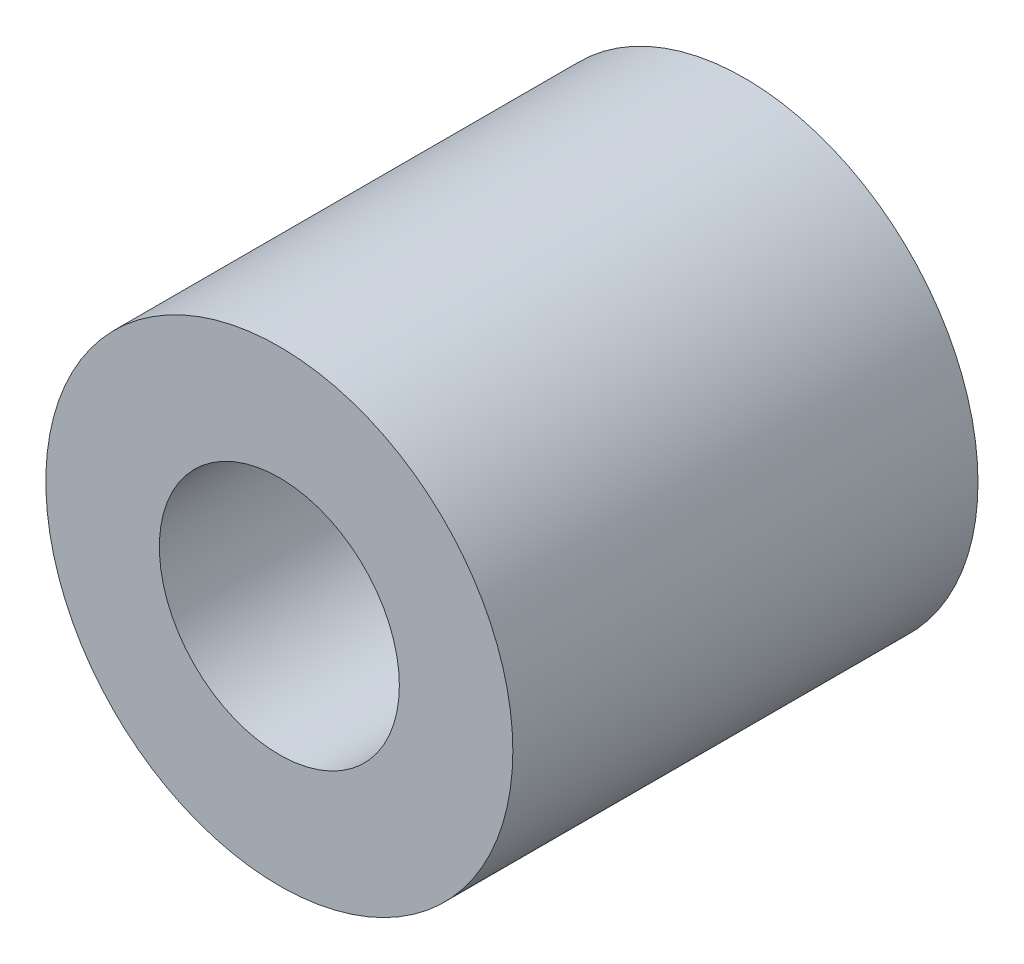
from build123d import *

# Parameters (mm, degrees)
SKETCH1_R      = 3.1877
SKETCH1_R_2    = 1.6383
EXTRUDE1_DEPTH = 3.175


with BuildPart() as part:
    # Sketch1 → Extrude1 (new, symmetric)
    with BuildSketch(Plane.XY):
        Circle(SKETCH1_R)
        Circle(SKETCH1_R_2, mode=Mode.SUBTRACT)
    extrude(amount=EXTRUDE1_DEPTH, both=True)


solid = part.part
